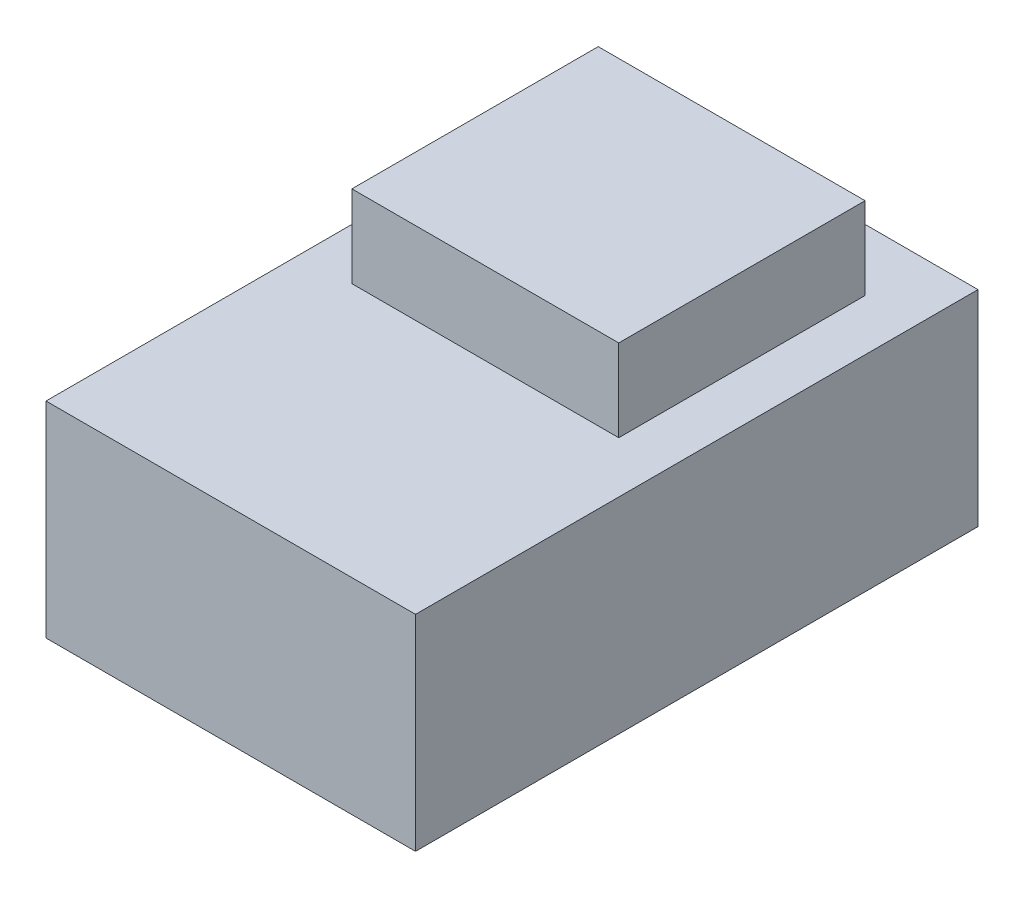
from build123d import *

# Parameters (mm, degrees)
SKIZZE1_W                       = 90
SKIZZE1_H                       = 50
AUFSATZ_LINEAR_AUSTRAGEN1_DEPTH = 137
SKIZZE2_W                       = 65
SKIZZE2_H                       = 60
AUFSATZ_LINEAR_AUSTRAGEN2_DEPTH = 20


with BuildPart() as part:
    # Skizze1 → Aufsatz-Linear austragen1 (new body)
    with BuildSketch(Plane.XY):
        Rectangle(SKIZZE1_W, SKIZZE1_H)
    extrude(amount=AUFSATZ_LINEAR_AUSTRAGEN1_DEPTH)

    # Skizze2 → Aufsatz-Linear austragen2 (add)
    with BuildSketch(Plane(origin=(0, 25, 0), x_dir=(1, 0, 0), z_dir=(0, 1, 0))):
        with Locations((0, -45)):
            Rectangle(SKIZZE2_W, SKIZZE2_H)
    extrude(amount=AUFSATZ_LINEAR_AUSTRAGEN2_DEPTH)


solid = part.part
